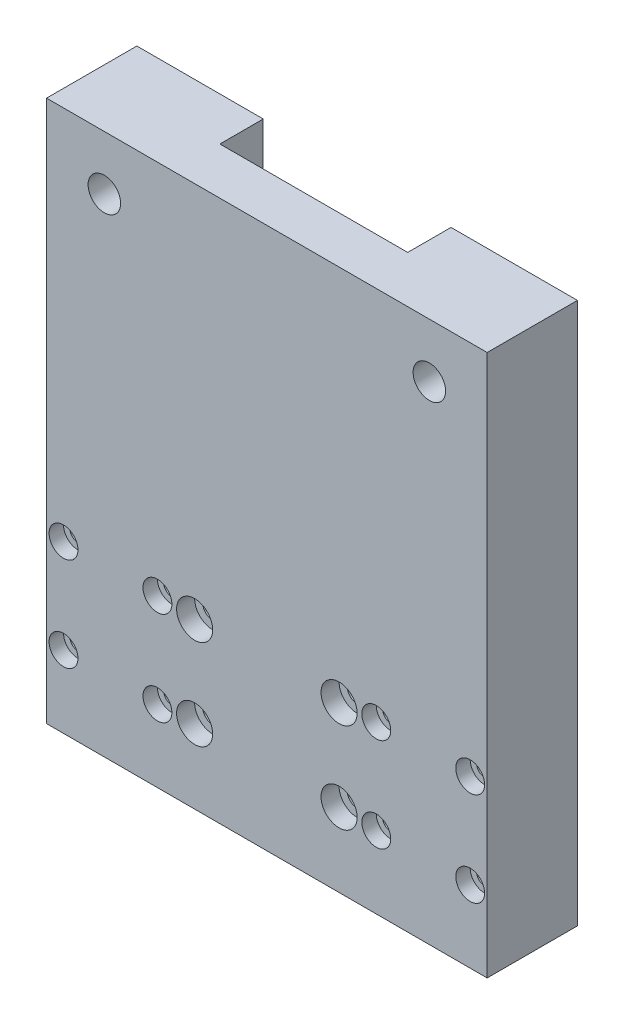
from build123d import *

# Parameters (mm, degrees)
SKETCH1_W                      = 122
SKETCH1_H                      = 150
BOSS_EXTRUDE1_DEPTH            = 25
CBORE_FOR_M4_SHCS1_D           = 4.5
CBORE_FOR_M4_SHCS1_CBORE_D     = 8
CBORE_FOR_M4_SHCS1_CBORE_DEPTH = 4
SKETCH4_W                      = 52
SKETCH4_H                      = 12
CUT_EXTRUDE1_DEPTH             = 195.958970042
CBORE_FOR_M5_SHCS1_D           = 5.5
CBORE_FOR_M5_SHCS1_CBORE_D     = 10
CBORE_FOR_M5_SHCS1_CBORE_DEPTH = 5
CBORE_FOR_M8_SHCS1_D           = 9
CBORE_FOR_M8_SHCS1_CBORE_D     = 15
CBORE_FOR_M8_SHCS1_CBORE_DEPTH = 8


with BuildPart() as part:
    # Sketch1 → Boss-Extrude1 (new body)
    with BuildSketch(Plane.XY):
        with Locations((61, 75)):
            Rectangle(SKETCH1_W, SKETCH1_H)
    extrude(amount=BOSS_EXTRUDE1_DEPTH)

    # CBORE for M4 SHCS1 (through all)
    with Locations(Plane(origin=(4.7, 46, 25), x_dir=(1, 0, 0), z_dir=(0, 0, 1))):
        with Locations((0, 0), (26, 0), (0, -26), (26, -26), (86.6, 0), (112.6, 0), (112.6, -26), (86.6, -26)):
            CounterBoreHole(CBORE_FOR_M4_SHCS1_D / 2, CBORE_FOR_M4_SHCS1_CBORE_D / 2, CBORE_FOR_M4_SHCS1_CBORE_DEPTH)

    # Sketch4 → Cut-Extrude1 (cut, through all)
    with BuildSketch(Plane(origin=(0, 0, 0), x_dir=(1, 0, 0), z_dir=(0, 1, 0))):
        with Locations((61, -6)):
            Rectangle(SKETCH4_W, SKETCH4_H)
    extrude(amount=CUT_EXTRUDE1_DEPTH, mode=Mode.SUBTRACT)

    # CBORE for M5 SHCS1 (through all)
    with Locations(Plane(origin=(41, 45.5, 25), x_dir=(1, 0, 0), z_dir=(0, 0, 1))):
        with Locations((0, 0), (40, 0), (40, -25), (0, -25)):
            CounterBoreHole(CBORE_FOR_M5_SHCS1_D / 2, CBORE_FOR_M5_SHCS1_CBORE_D / 2, CBORE_FOR_M5_SHCS1_CBORE_DEPTH)

    # CBORE for M8 SHCS1 (through all)
    with Locations(Plane(origin=(106, 135, 0), x_dir=(-1, 0, 0), z_dir=(0, 0, -1))):
        with Locations((0, 0), (90, 0)):
            CounterBoreHole(CBORE_FOR_M8_SHCS1_D / 2, CBORE_FOR_M8_SHCS1_CBORE_D / 2, CBORE_FOR_M8_SHCS1_CBORE_DEPTH)


solid = part.part
